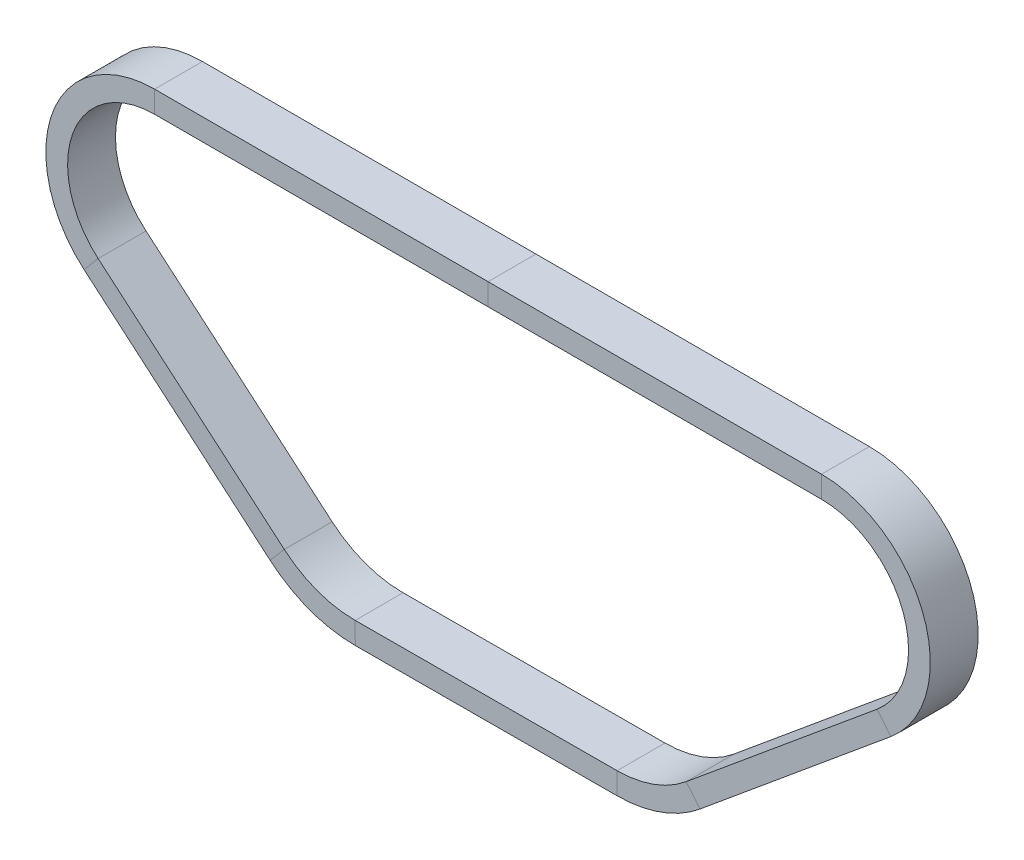
from build123d import *

# Parameters (mm, degrees)
SKETCH2_W = 110
SKETCH2_H = 50


with BuildPart() as part:
    # Sweep1: sweep along a path in Sketch1
    with BuildLine(Plane.XY) as sweep1_path:
        Line((-912.346371266, 17.248432286), (-484.609419586, -347.641186818))
        ThreePointArc((-484.609419586, -347.641186818), (-400.846110251, -396.600536066), (-305.293587219, -413.423889224))
        Line((-305.293587219, -413.423889224), (296.584695505, -411.585638844))
        ThreePointArc((296.584695505, -411.585638844), (389.399353839, -395.147985871), (471.211063424, -348.333443136))
        Line((471.211063424, -348.333443136), (909.883915619, 15.178017715))
        ThreePointArc((909.883915619, 15.178017715), (977.987337549, 264.728482124), (766.320606962, 413.425171825))
        Line((766.320606962, 413.425171825), (-766.320606962, 413.425171825))
        ThreePointArc((-766.320606962, 413.425171825), (-977.436412145, 266.239802852), (-912.346371266, 17.248432286))
    # Sketch2 → Sweep1 (sweep)
    with BuildSketch(Plane(origin=(0, 0, 0), x_dir=(0, 0, -1), z_dir=(1, 0, 0))):
        with Locations((0, 413.425171825)):
            Rectangle(SKETCH2_W, SKETCH2_H)
    sweep(path=sweep1_path.line)


solid = part.part
